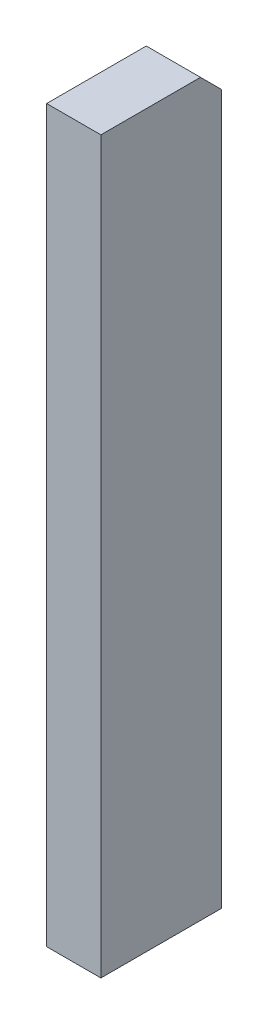
from build123d import *

# Parameters (mm, degrees)
SKETCH1_W           = 2.6
SKETCH1_H           = 35
BOSS_EXTRUDE1_DEPTH = 5.775
CHAMFER1_SIZE       = 1


with BuildPart() as part:
    # Sketch1 → Boss-Extrude1 (new body)
    with BuildSketch(Plane.XY):
        with Locations((1.3, 17.5)):
            Rectangle(SKETCH1_W, SKETCH1_H)
    extrude(amount=BOSS_EXTRUDE1_DEPTH)

    # Chamfer1
    chamfer1_edges = [part.edges().sort_by_distance(p)[0] for p in [
        (1.3, 35, 0),
    ]]
    chamfer(chamfer1_edges, length=CHAMFER1_SIZE)


solid = part.part
